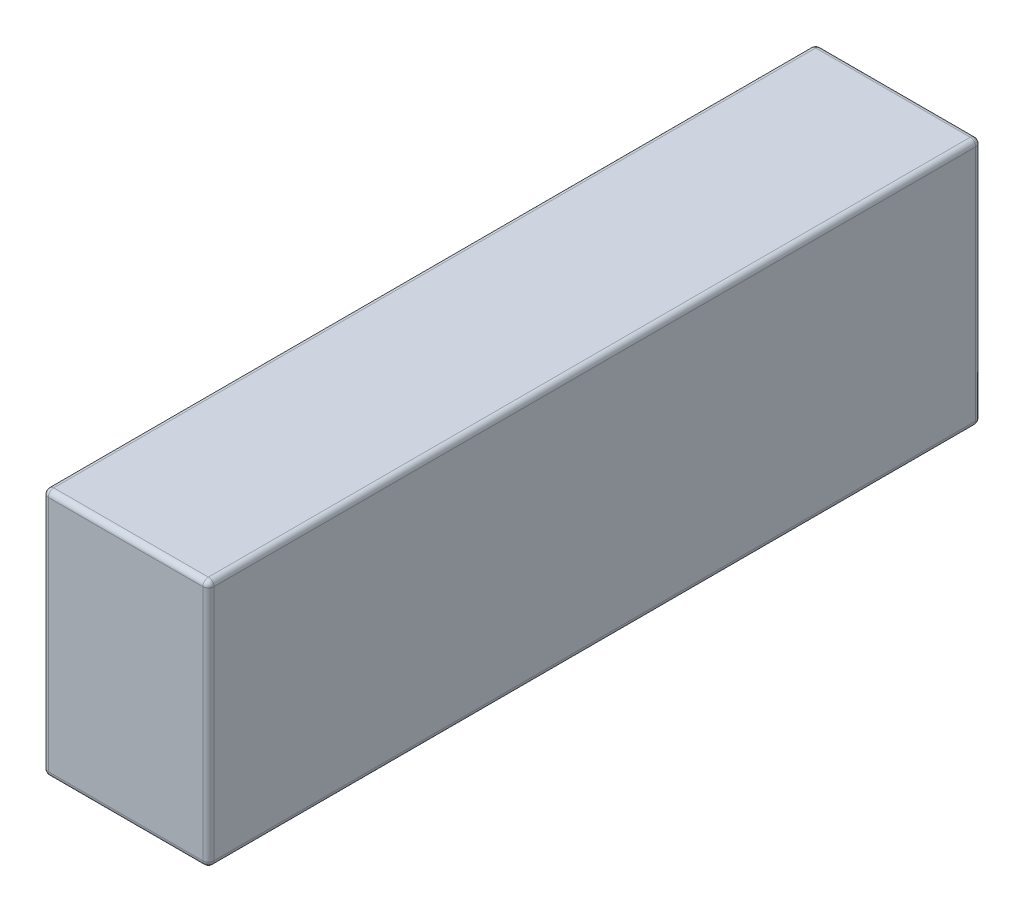
from build123d import *

# Parameters (mm, degrees)
SKETCH1_W           = 30
SKETCH1_H           = 140
BOSS_EXTRUDE1_DEPTH = 45
FILLET1_R           = 1


with BuildPart() as part:
    # Sketch1 → Boss-Extrude1 (new body)
    with BuildSketch(Plane(origin=(0, 0, 0), x_dir=(1, 0, 0), z_dir=(0, 1, 0))):
        Rectangle(SKETCH1_W, SKETCH1_H)
    extrude(amount=BOSS_EXTRUDE1_DEPTH)

    # Fillet1
    fillet1_edges = [part.edges().sort_by_distance(p)[0] for p in [
        (15, 45, 0),
        (0, 45, -70),
        (-15, 45, 0),
        (0, 0, -70),
        (15, 0, 0),
        (0, 0, 70),
        (-15, 0, 0),
        (0, 45, 70),
        (-15, 22.5, -70),
        (15, 22.5, -70),
        (15, 22.5, 70),
        (-15, 22.5, 70),
    ]]
    fillet(fillet1_edges, radius=FILLET1_R)


solid = part.part
